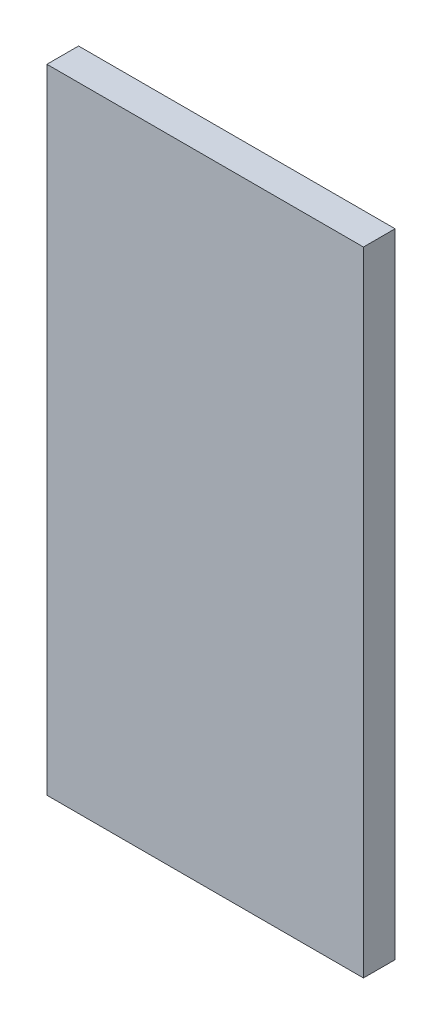
from build123d import *

# Parameters (mm, degrees)
SKETCH1_W           = 10
SKETCH1_H           = 20
BOSS_EXTRUDE1_DEPTH = 1


with BuildPart() as part:
    # Sketch1 → Boss-Extrude1 (new body)
    with BuildSketch(Plane.XY):
        with Locations((5, 10)):
            Rectangle(SKETCH1_W, SKETCH1_H)
    extrude(amount=BOSS_EXTRUDE1_DEPTH)


solid = part.part
